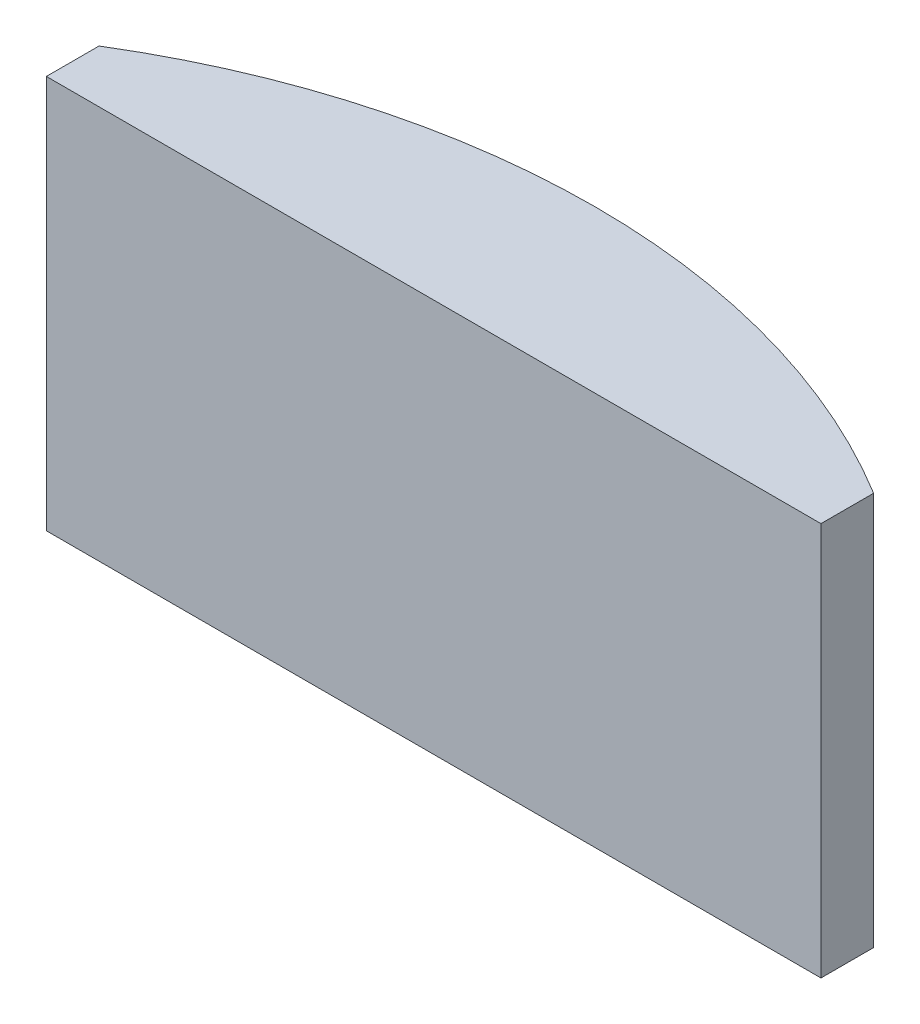
from build123d import *

# Parameters (mm, degrees)
BOSS_EXTRUDE1_DEPTH = 6.35
SKETCH2_W           = 25
SKETCH2_H           = 12.7
BOSS_EXTRUDE2_DEPTH = 1.7


with BuildPart() as part:
    # Sketch1 → Boss-Extrude1 (new, symmetric)
    with BuildSketch(Plane(origin=(0, 0, 0), x_dir=(1, 0, 0), z_dir=(0, 1, 0))):
        with BuildLine():
            Line((-12.5, 20.487801249), (12.5, 20.487801249))
            ThreePointArc((12.5, 20.487801249), (0, 24), (-12.5, 20.487801249))
        make_face()
    extrude(amount=BOSS_EXTRUDE1_DEPTH, both=True)

    # Sketch2 → Boss-Extrude2 (add)
    with BuildSketch(Plane.XY.offset(-20.487801249)):
        Rectangle(SKETCH2_W, SKETCH2_H)
    extrude(amount=BOSS_EXTRUDE2_DEPTH)


solid = part.part
